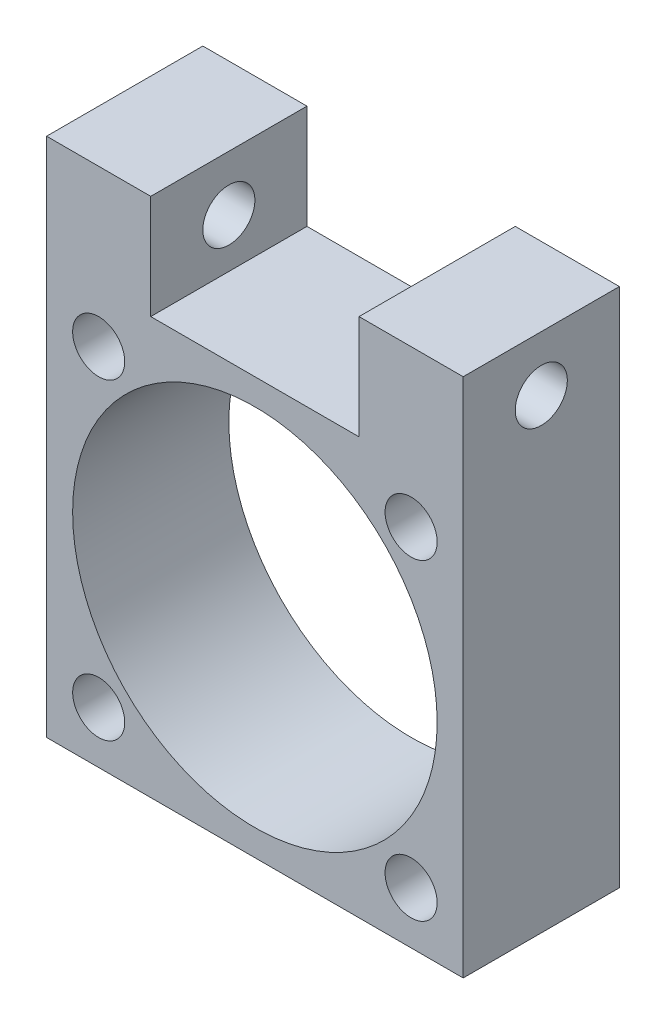
from build123d import *

# Parameters (mm, degrees)
SKETCH1_W           = 50.8
SKETCH1_H           = 50.8
BOSS_EXTRUDE1_DEPTH = 19.05
SKETCH2_R           = 22.225
CUT_EXTRUDE1_DEPTH  = 25.4
SKETCH3_W           = 19.05
SKETCH3_H           = 12.7
SKETCH3_R           = 3.175
BOSS_EXTRUDE2_DEPTH = 12.7
SKETCH4_R           = 3.175
CUT_EXTRUDE2_DEPTH  = 50.595085442


with BuildPart() as part:
    # Sketch1 → Boss-Extrude1 (new body)
    with BuildSketch(Plane.XY):
        Rectangle(SKETCH1_W, SKETCH1_H)
    extrude(amount=BOSS_EXTRUDE1_DEPTH)

    # Sketch2 → Cut-Extrude1 (cut)
    with BuildSketch(Plane(origin=(0, 0, 0), x_dir=(-1, 0, 0), z_dir=(0, 0, -1))):
        Circle(SKETCH2_R)
    extrude(amount=-CUT_EXTRUDE1_DEPTH, mode=Mode.SUBTRACT)

    # Sketch3 → Boss-Extrude2 (add)
    with BuildSketch(Plane.ZY.offset(25.4)):
        with Locations((9.525, 31.75)):
            Rectangle(SKETCH3_W, SKETCH3_H)
        with Locations(Location((9.525, 31.363785976, 0), (0, 0, 270))):
            Circle(SKETCH3_R, mode=Mode.SUBTRACT)
    boss_extrude2 = extrude(amount=-BOSS_EXTRUDE2_DEPTH)

    # Mirror1: Boss-Extrude2 across plane
    add(boss_extrude2.mirror(Plane(origin=(0, 0, 0), x_dir=(0, 0, 1), z_dir=(1, 0, 0))))

    # Sketch4 → Cut-Extrude2 (cut, through all)
    with BuildSketch(Plane(origin=(0, 0, 0), x_dir=(-1, 0, 0), z_dir=(0, 0, -1))):
        with Locations((-19.05, 19.05)):
            Circle(SKETCH4_R)
        with Locations((19.05, 19.05)):
            Circle(SKETCH4_R)
        with Locations((19.05, -19.05)):
            Circle(SKETCH4_R)
        with Locations((-19.05, -19.05)):
            Circle(SKETCH4_R)
    extrude(amount=-CUT_EXTRUDE2_DEPTH, mode=Mode.SUBTRACT)


solid = part.part
